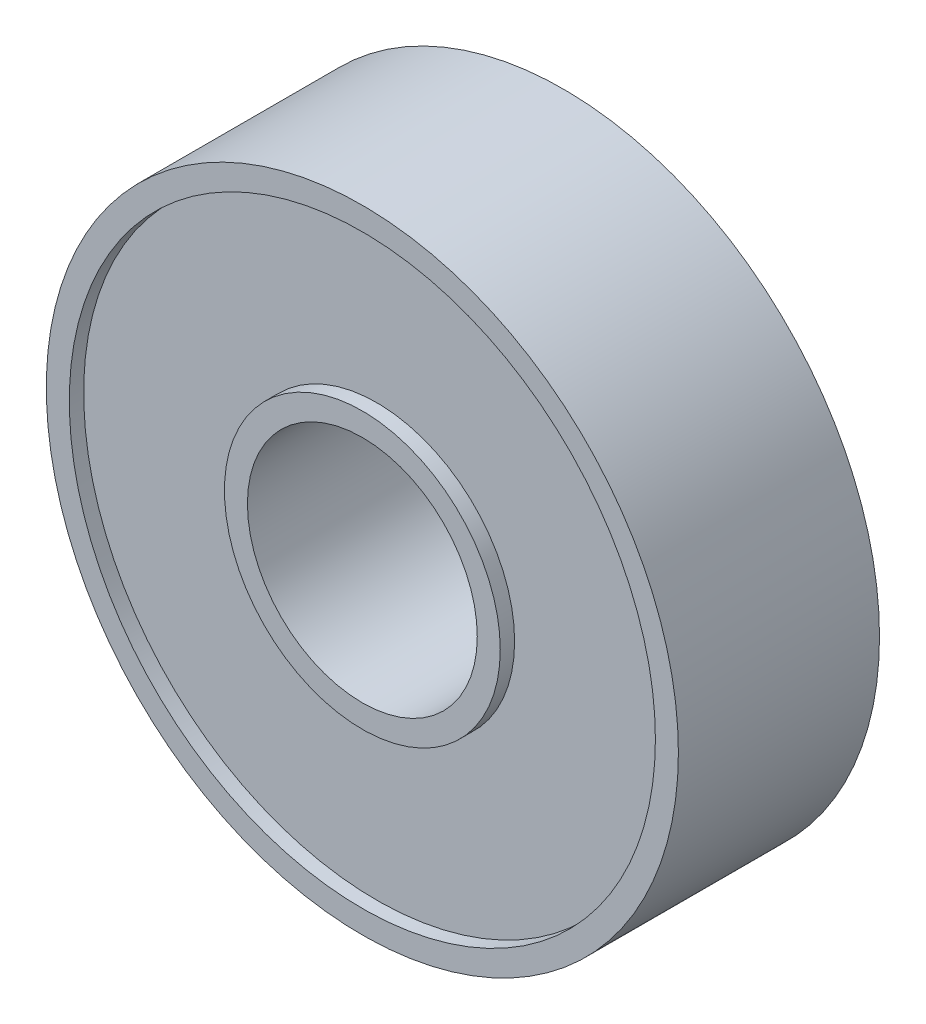
from build123d import *


with BuildPart() as part:
    # Sketch2 → Revolve1 (revolve)
    with BuildSketch(Plane(origin=(0, 0, 0), x_dir=(0, 0, -1), z_dir=(1, 0, 0)), mode=Mode.PRIVATE) as revolve1_sk:
        Polygon((0, 4), (-3.5, 4), (-3.5, 4.8), (-3, 4.8), (-3, 10.2), (-3.5, 10.2), (-3.5, 11), (3.5, 11), (3.5, 10.2), (3, 10.2), (3, 4.8), (3.5, 4.8), (3.5, 4), align=None)
    revolve(revolve1_sk.sketch.rotate(Axis((0, 0, 4.53807108), (0, 0, -1)), 90), axis=Axis((0, 0, 4.53807108), (0, 0, -1)))


solid = part.part
